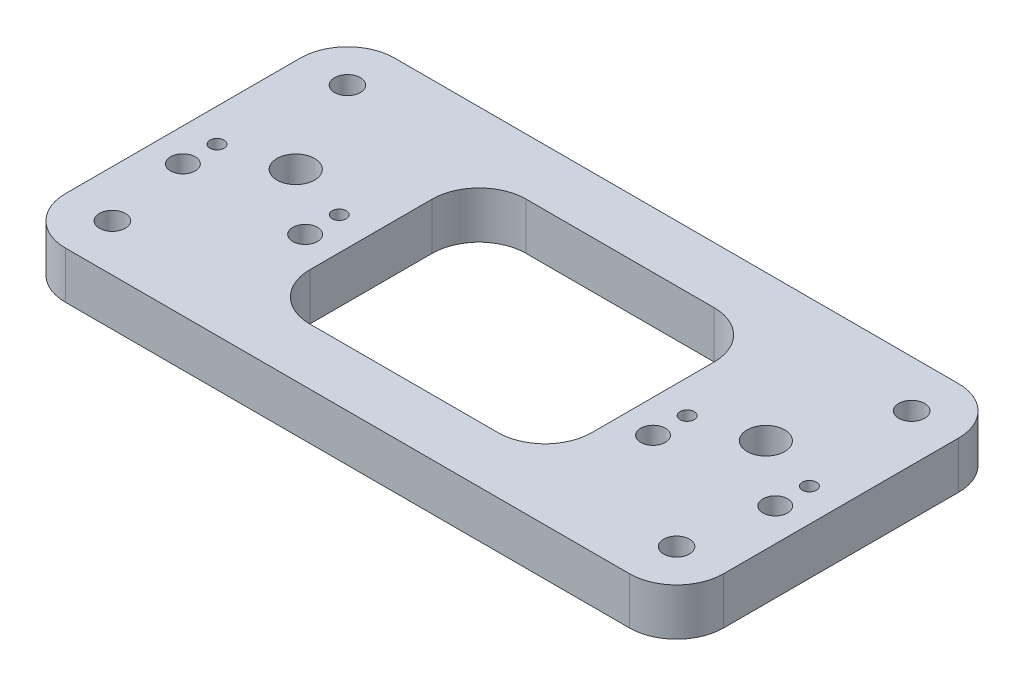
from build123d import *

# Parameters (mm, degrees)
SKETCH1_W           = 140
SKETCH1_H           = 70
BOSS_EXTRUDE1_DEPTH = 10
FILLET1_R           = 10
SKETCH2_R           = 2.75
CUT_EXTRUDE1_DEPTH  = 79.89866919
SKETCH3_R           = 4
CUT_EXTRUDE2_DEPTH  = 79.89866919
SKETCH4_R           = 2.625
SKETCH4_R_2         = 1.5
CUT_EXTRUDE3_DEPTH  = 79.89866919
SKETCH5_W           = 60
SKETCH5_H           = 46
CUT_EXTRUDE4_DEPTH  = 79.89866919
FILLET3_R           = 10


with BuildPart() as part:
    # Sketch1 → Boss-Extrude1 (new body)
    with BuildSketch(Plane(origin=(0, 0, 0), x_dir=(1, 0, 0), z_dir=(0, 1, 0))):
        Rectangle(SKETCH1_W, SKETCH1_H)
    extrude(amount=BOSS_EXTRUDE1_DEPTH)

    # Fillet1
    fillet1_edges = [part.edges().sort_by_distance(p)[0] for p in [
        (70, 5, 35),
        (-70, 5, 35),
        (-70, 5, -35),
        (70, 5, -35),
    ]]
    fillet(fillet1_edges, radius=FILLET1_R)

    # Sketch2 → Cut-Extrude1 (cut, through all)
    with BuildSketch(Plane(origin=(0, 10, 0), x_dir=(1, 0, 0), z_dir=(0, 1, 0))):
        with Locations(Location((-60, -25, 0), (0, 0, 270))):
            Circle(SKETCH2_R)
        with Locations(Location((-60, 25, 0), (0, 0, 90))):
            Circle(SKETCH2_R)
        with Locations(Location((60, -25, 0), (0, 0, 90))):
            Circle(SKETCH2_R)
        with Locations(Location((60, 25, 0), (0, 0, 270))):
            Circle(SKETCH2_R)
    extrude(amount=-CUT_EXTRUDE1_DEPTH, mode=Mode.SUBTRACT)

    # Sketch3 → Cut-Extrude2 (cut, through all)
    with BuildSketch(Plane(origin=(0, 10, 0), x_dir=(1, 0, 0), z_dir=(0, 1, 0))):
        with Locations(Location((-50, 4, 0), (0, 0, 270))):
            Circle(SKETCH3_R)
        with Locations(Location((50, 4, 0), (0, 0, 90))):
            Circle(SKETCH3_R)
    extrude(amount=-CUT_EXTRUDE2_DEPTH, mode=Mode.SUBTRACT)

    # Sketch4 → Cut-Extrude3 (cut, through all)
    with BuildSketch(Plane(origin=(0, 10, 0), x_dir=(1, 0, 0), z_dir=(0, 1, 0))):
        with Locations(Location((-63, -7, 0), (0, 0, 270))):
            Circle(SKETCH4_R)
        with Locations(Location((-37, -7, 0), (0, 0, 270))):
            Circle(SKETCH4_R)
        with Locations(Location((37, -7, 0), (0, 0, 270))):
            Circle(SKETCH4_R)
        with Locations(Location((63, -7, 0), (0, 0, 270))):
            Circle(SKETCH4_R)
        with Locations(Location((-63, 0.25, 0), (0, 0, 270))):
            Circle(SKETCH4_R_2)
        with Locations(Location((-37, 0.25, 0), (0, 0, 270))):
            Circle(SKETCH4_R_2)
        with Locations(Location((37, 0.25, 0), (0, 0, 270))):
            Circle(SKETCH4_R_2)
        with Locations(Location((63, 0.25, 0), (0, 0, 270))):
            Circle(SKETCH4_R_2)
    extrude(amount=-CUT_EXTRUDE3_DEPTH, mode=Mode.SUBTRACT)

    # Sketch5 → Cut-Extrude4 (cut, through all)
    with BuildSketch(Plane(origin=(0, 10, 0), x_dir=(1, 0, 0), z_dir=(0, 1, 0))):
        Rectangle(SKETCH5_W, SKETCH5_H)
    extrude(amount=-CUT_EXTRUDE4_DEPTH, mode=Mode.SUBTRACT)

    # Fillet3
    fillet3_edges = [part.edges().sort_by_distance(p)[0] for p in [
        (-30, 5, 23),
        (-30, 5, -23),
        (30, 5, -23),
        (30, 5, 23),
    ]]
    fillet(fillet3_edges, radius=FILLET3_R)


solid = part.part
